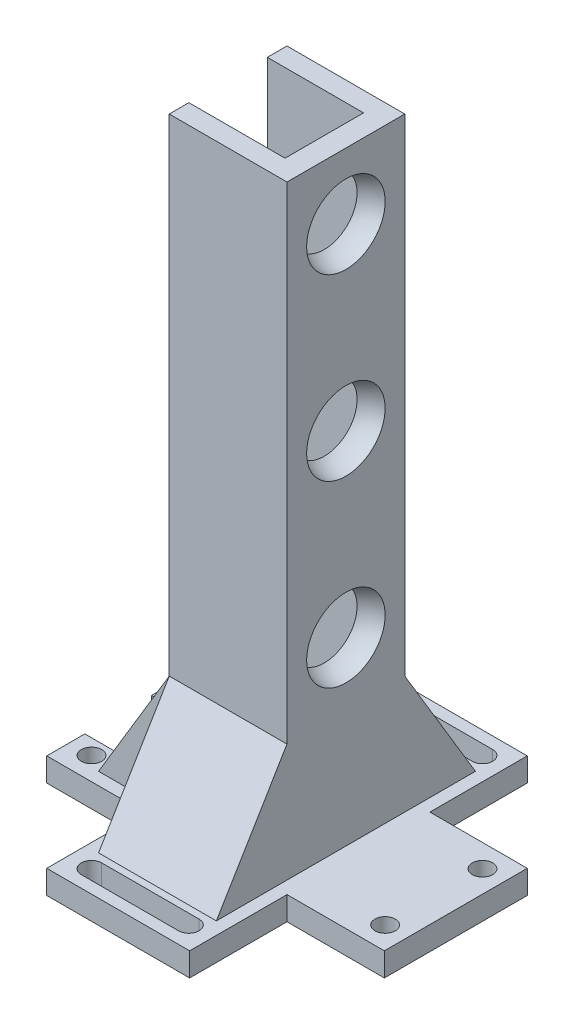
from build123d import *

# Parameters (mm, degrees)
SKETCH_1_W                  = 86
SKETCH_1_H                  = 86
EXTRUDE_1_DEPTH             = 6
SKETCH_2_W                  = 30
SKETCH_2_H                  = 30
EXTRUDE_2_DEPTH             = 160
EXTRUDE_3_REACH             = 173.167
EXTRUDE_3_DIRECTION_2_REACH = 173.167
SKETCH_8_R                  = 2.6
CUT_EXTRUDE_2_DEPTH         = 6
CUT_EXTRUDE_3_DEPTH         = 6
PATTERN_LINEAR_1_COUNT      = 3
PATTERN_LINEAR_1_PITCH      = 45.6
MIRROR_7_COPY_1_DEPTH       = 6
MIRROR_8_COPY_1_SKETCH_R    = 2.6
MIRROR_8_COPY_1_DEPTH       = 6
PATTERN_CIRCULAR_1_COUNT    = 2
PATTERN_CIRCULAR_1_ANGLE    = 90
MIRROR_9_COPY_1_SKETCH_R    = 2.6
MIRROR_9_COPY_1_DEPTH       = 6
MIRROR_9_COPY_2_SKETCH_R    = 2.6
MIRROR_9_COPY_2_DEPTH       = 6
MIRROR_10_COPY_1_SKETCH_R   = 2.6
MIRROR_10_COPY_1_DEPTH      = 6
MIRROR_10_COPY_2_SKETCH_R   = 2.6
MIRROR_10_COPY_2_DEPTH      = 6
MIRROR_10_COPY_3_SKETCH_R   = 2.6
MIRROR_10_COPY_3_DEPTH      = 6
MIRROR_10_COPY_4_SKETCH_R   = 2.6
MIRROR_10_COPY_4_DEPTH      = 6
MIRROR_10_COPY_5_SKETCH_R   = 2.6
MIRROR_10_COPY_5_DEPTH      = 6
EXTRUDE_4_DEPTH             = 15
CUT_EXTRUDE_4_DEPTH         = 9.5
CUT_EXTRUDE_4_DEPTH_BACK    = 172.166585524
SKETCH_17_W                 = 20
SKETCH_17_H                 = 154
SKETCH_19_W                 = 24.8
SKETCH_19_H                 = 5.2
CUT_EXTRUDE_6_DEPTH         = 172.166585524
CUT_EXTRUDE_8_DEPTH         = 9.5
CUT_EXTRUDE_8_DEPTH_BACK    = 172.166585524
SKETCH_21_W                 = 17
SKETCH_21_H                 = 6


with BuildPart() as part:
    # 草图1 → 凸台-拉伸1 (new body)
    with BuildSketch(Plane(origin=(0, 0, 0), x_dir=(1, 0, 0), z_dir=(0, 1, 0))):
        Rectangle(SKETCH_1_W, SKETCH_1_H)
    extrude(amount=EXTRUDE_1_DEPTH)

    # 草图2 → 凸台-拉伸2 (add)
    with BuildSketch(Plane(origin=(0, 0, 0), x_dir=(1, 0, 0), z_dir=(0, 1, 0))):
        Rectangle(SKETCH_2_W, SKETCH_2_H)
    extrude(amount=EXTRUDE_2_DEPTH)

    # 凸台-拉伸3: up to this face of the body (flat: up to its plane)
    extrude_3_end = Plane(part.part.faces().sort_by_distance((0, 83, 15))[0])
    # 草图7 → 凸台-拉伸3 (add, up to the picked face)
    with BuildSketch(Plane.XY, mode=Mode.PRIVATE) as extrude_3_sk1:
        Polygon((-15, 36), (-33, 6), (-15, 6), align=None)
    extrude_3_tool1 = split(extrude(extrude_3_sk1.sketch, amount=EXTRUDE_3_REACH, mode=Mode.PRIVATE), bisect_by=extrude_3_end, keep=Keep.BOTH, mode=Mode.PRIVATE)
    add(extrude_3_tool1.solids().sort_by(Axis((-21, 16, 0), (0, 0, 1)))[0])

    # 凸台-拉伸3 direction 2: up to this face of the body (flat: up to its plane)
    extrude_3_direction_2_end = Plane(part.part.faces().sort_by_distance((0, 83, -15))[0])
    # 草图7 → 凸台-拉伸3 direction 2 (add, up to the picked face)
    with BuildSketch(Plane.XY, mode=Mode.PRIVATE) as extrude_3_direction_2_sk1:
        Polygon((-15, 36), (-33, 6), (-15, 6), align=None)
    extrude_3_direction_2_tool1 = split(extrude(extrude_3_direction_2_sk1.sketch, amount=-EXTRUDE_3_DIRECTION_2_REACH, mode=Mode.PRIVATE), bisect_by=extrude_3_direction_2_end, keep=Keep.BOTH, mode=Mode.PRIVATE)
    add(extrude_3_direction_2_tool1.solids().sort_by(Axis((-21, 16, 0), (0, 0, -1)))[0])

    # 草图8 → 切除-拉伸2 (cut)
    with BuildSketch(Plane(origin=(0, 0, 0), x_dir=(1, 0, 0), z_dir=(0, 1, 0))):
        with Locations(Location((-12.4, 37.4, 0), (0, 0, 270))):
            Circle(SKETCH_8_R)
    cut_extrude_2 = extrude(amount=CUT_EXTRUDE_2_DEPTH, mode=Mode.SUBTRACT)

    # 镜向2: 切除-拉伸2 across plane
    add(cut_extrude_2.mirror(Plane.XY), mode=Mode.SUBTRACT)

    # 草图11 → 切除-拉伸3 (cut)
    with BuildSketch(Plane(origin=(0, 0, 0), x_dir=(1, 0, 0), z_dir=(0, 1, 0))):
        Polygon((264.106039705, -18.2), (43, -18.2), (18.2, -18.2), (18.2, -43), (18.2, -264.106039705), (330.891160074, -576.797199779), (576.797199779, -330.891160074), align=None)
    cut_extrude_3 = extrude(amount=CUT_EXTRUDE_3_DEPTH, mode=Mode.SUBTRACT)

    # 草图12 → 切除-旋转2 (revolve, cut)
    with BuildSketch(Plane.XY):
        with BuildLine():
            Line((15, 62), (15, 42))
            ThreePointArc((15, 42), (5, 52), (15, 62))
        make_face()
    cut_revolve_2 = revolve(axis=Axis((15, 62, 0), (0, -1, 0)), mode=Mode.SUBTRACT)

    # 阵列(线性)1: 切除-旋转2 ×3
    with Locations(*[(0, i * PATTERN_LINEAR_1_PITCH, 0) for i in range(1, PATTERN_LINEAR_1_COUNT)]):
        add(cut_revolve_2, mode=Mode.SUBTRACT)

    # 镜向6: 切除-拉伸3 across plane
    add(cut_extrude_3.mirror(Plane.XY), mode=Mode.SUBTRACT)

    # 镜向7: 切除-拉伸3 across plane
    add(cut_extrude_3.mirror(Plane(origin=(0, 0, 0), x_dir=(0, 0, 1), z_dir=(1, 0, 0))), mode=Mode.SUBTRACT)

    # 镜向7 copy 1 sketch → 镜向7 copy 1 (cut)
    with BuildSketch(Plane(origin=(0, 0, 0), x_dir=(-1, 0, 0), z_dir=(0, 1, 0))):
        Polygon((264.106039705, -18.2), (43, -18.2), (18.2, -18.2), (18.2, -43), (18.2, -264.106039705), (330.891160074, -576.797199779), (576.797199779, -330.891160074), align=None)
    extrude(amount=MIRROR_7_COPY_1_DEPTH, mode=Mode.SUBTRACT)

    # 镜向8: 切除-拉伸2 across plane
    add(cut_extrude_2.mirror(Plane(origin=(0, 0, 0), x_dir=(0, 0, 1), z_dir=(1, 0, 0))), mode=Mode.SUBTRACT)

    # 镜向8 copy 1 sketch → 镜向8 copy 1 (cut)
    with BuildSketch(Plane(origin=(0, 0, 0), x_dir=(-1, 0, 0), z_dir=(0, 1, 0))):
        with Locations(Location((-12.4, 37.4, 0), (0, 0, 270))):
            Circle(MIRROR_8_COPY_1_SKETCH_R)
    extrude(amount=MIRROR_8_COPY_1_DEPTH, mode=Mode.SUBTRACT)

    # 阵列(圆周)1: 切除-拉伸2 ×2 about axis
    pattern_circular_1_axis = Axis((0, 0, 0), (0, 1, 0))
    for i in range(1, PATTERN_CIRCULAR_1_COUNT):
        add(cut_extrude_2.rotate(pattern_circular_1_axis, i * PATTERN_CIRCULAR_1_ANGLE / (PATTERN_CIRCULAR_1_COUNT - 1)), mode=Mode.SUBTRACT)

    # 镜向9 copy 1 sketch → 镜向9 copy 1 (cut)
    with BuildSketch(Plane.ZX):
        with Locations((-12.4, -37.4)):
            Circle(MIRROR_9_COPY_1_SKETCH_R)
    extrude(amount=MIRROR_9_COPY_1_DEPTH, mode=Mode.SUBTRACT)

    # 镜向9 copy 2 sketch → 镜向9 copy 2 (cut)
    with BuildSketch(Plane(origin=(0, 0, 0), x_dir=(1, 0, 0), z_dir=(0, 1, 0))):
        with Locations((-12.4, -37.4)):
            Circle(MIRROR_9_COPY_2_SKETCH_R)
    extrude(amount=MIRROR_9_COPY_2_DEPTH, mode=Mode.SUBTRACT)

    # 镜向10 copy 1 sketch → 镜向10 copy 1 (cut)
    with BuildSketch(Plane(origin=(0, 0, 0), x_dir=(0, 0, -1), z_dir=(0, 1, 0))):
        with Locations((-12.4, -37.4)):
            Circle(MIRROR_10_COPY_1_SKETCH_R)
    extrude(amount=MIRROR_10_COPY_1_DEPTH, mode=Mode.SUBTRACT)

    # 镜向10 copy 2 sketch → 镜向10 copy 2 (cut)
    with BuildSketch(Plane(origin=(0, 0, 0), x_dir=(-1, 0, 0), z_dir=(0, 1, 0))):
        with Locations((-12.4, -37.4)):
            Circle(MIRROR_10_COPY_2_SKETCH_R)
    extrude(amount=MIRROR_10_COPY_2_DEPTH, mode=Mode.SUBTRACT)

    # 镜向10 copy 3 sketch → 镜向10 copy 3 (cut)
    with BuildSketch(Plane.ZX):
        with Locations(Location((-12.4, 37.4, 0), (0, 0, 270))):
            Circle(MIRROR_10_COPY_3_SKETCH_R)
    extrude(amount=MIRROR_10_COPY_3_DEPTH, mode=Mode.SUBTRACT)

    # 镜向10 copy 4 sketch → 镜向10 copy 4 (cut)
    with BuildSketch(Plane(origin=(0, 0, 0), x_dir=(-1, 0, 0), z_dir=(0, 1, 0))):
        with Locations(Location((-12.4, 37.4, 0), (0, 0, 270))):
            Circle(MIRROR_10_COPY_4_SKETCH_R)
    extrude(amount=MIRROR_10_COPY_4_DEPTH, mode=Mode.SUBTRACT)

    # 镜向10 copy 5 sketch → 镜向10 copy 5 (cut)
    with BuildSketch(Plane(origin=(0, 0, 0), x_dir=(-1, 0, 0), z_dir=(0, 1, 0))):
        with Locations((-12.4, -37.4)):
            Circle(MIRROR_10_COPY_5_SKETCH_R)
    extrude(amount=MIRROR_10_COPY_5_DEPTH, mode=Mode.SUBTRACT)

    # 草图15 → 凸台-拉伸4 (add, symmetric)
    with BuildSketch(Plane(origin=(0, 0, 0), x_dir=(0, 0, -1), z_dir=(1, 0, 0))):
        Polygon((-15, 36), (-15, 6), (-33, 6), align=None)
    extrude_4 = extrude(amount=EXTRUDE_4_DEPTH, both=True)

    # 镜向11: 凸台-拉伸4 across plane
    add(extrude_4.mirror(Plane.XY))

    # 草图17 → 切除-拉伸4 (cut, two sides: drawn at the far end of the back side and taken through both)
    with BuildSketch(Plane(origin=(0, 0, 0), x_dir=(0, 0, -1), z_dir=(1, 0, 0)).offset(-CUT_EXTRUDE_4_DEPTH_BACK)):
        with Locations((0, 83)):
            Rectangle(SKETCH_17_W, SKETCH_17_H)
    extrude(amount=CUT_EXTRUDE_4_DEPTH + CUT_EXTRUDE_4_DEPTH_BACK, mode=Mode.SUBTRACT)

    # 草图19 → 切除-拉伸6 (cut, through all)
    with BuildSketch(Plane(origin=(0, 0, 0), x_dir=(1, 0, 0), z_dir=(0, 1, 0))):
        with Locations((0, 37.4)):
            Rectangle(SKETCH_19_W, SKETCH_19_H)
    cut_extrude_6 = extrude(amount=CUT_EXTRUDE_6_DEPTH, mode=Mode.SUBTRACT)

    # 镜向12: 切除-拉伸6 across plane
    add(cut_extrude_6.mirror(Plane.XY), mode=Mode.SUBTRACT)

    # 草图21 → 切除-拉伸8 (cut, two sides: drawn at the far end of the back side and taken through both)
    with BuildSketch(Plane(origin=(0, 0, 0), x_dir=(0, 0, -1), z_dir=(1, 0, 0)).offset(-CUT_EXTRUDE_8_DEPTH_BACK)):
        with Locations((0, 3)):
            Rectangle(SKETCH_21_W, SKETCH_21_H)
    extrude(amount=CUT_EXTRUDE_8_DEPTH + CUT_EXTRUDE_8_DEPTH_BACK, mode=Mode.SUBTRACT)


solid = part.part
